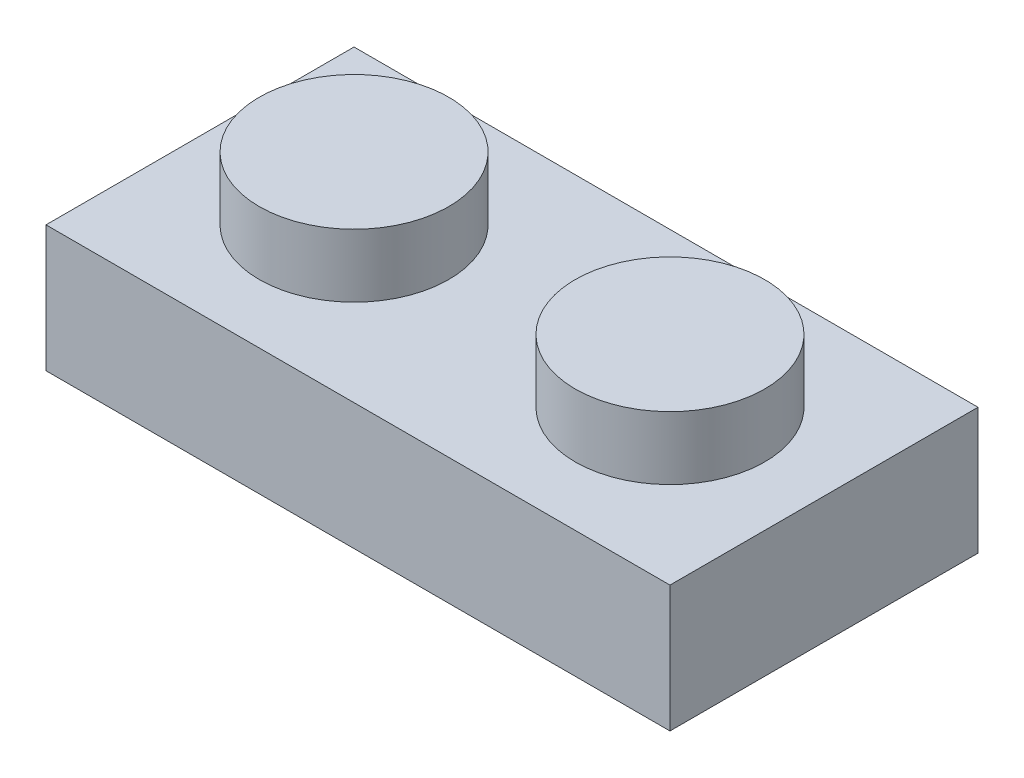
from build123d import *

# Parameters (mm, degrees)
SKETCH1_W            = 15.8
SKETCH1_H            = 3.2
BOSS_EXTRUDE1_DEPTH  = 7.8
SKETCH2_R            = 2.4
BOSS_EXTRUDE2_DEPTH  = 1.6
LPATTERN1_COUNT      = 2
LPATTERN1_PITCH      = 8
LPATTERN1_COUNT_DIR2 = 6
LPATTERN1_PITCH_DIR2 = 8
SHELL1_T             = -1.2
SKETCH3_R            = 1.5
SKETCH3_R_2          = 0.6
BOSS_EXTRUDE3_DEPTH  = 1.8


with BuildPart() as part:
    # Sketch1 → Boss-Extrude1 (new body)
    with BuildSketch(Plane.XY):
        with Locations((7.9, 1.6)):
            Rectangle(SKETCH1_W, SKETCH1_H)
    extrude(amount=-BOSS_EXTRUDE1_DEPTH)

    # Sketch2 → Boss-Extrude2 (add)
    with BuildSketch(Plane(origin=(0, 3.2, 0), x_dir=(1, 0, 0), z_dir=(0, 1, 0))):
        with Locations(Location((3.9, 3.9, 0), (0, 0, 270))):
            Circle(SKETCH2_R)
    boss_extrude2 = extrude(amount=BOSS_EXTRUDE2_DEPTH)

    # LPattern1: Boss-Extrude2 2 × 6, 10 skipped
    with Locations(*[(j * LPATTERN1_PITCH_DIR2, 0, i * LPATTERN1_PITCH) for i in range(LPATTERN1_COUNT) for j in range(LPATTERN1_COUNT_DIR2) if (i, j) not in ((0, 0), (0, 2), (0, 3), (0, 4), (0, 5), (1, 0), (1, 1), (1, 2), (1, 3), (1, 4), (1, 5))]):
        add(boss_extrude2)

    # Shell1
    shell1_openings = [part.faces().sort_by_distance(p)[0] for p in [
        (7.9, 0, -3.9),
    ]]
    offset(amount=SHELL1_T, openings=shell1_openings, kind=Kind.INTERSECTION)

    # Sketch3 → Boss-Extrude3 (add)
    with BuildSketch(Plane.XZ.offset(-2)):
        with Locations(Location((7.9, -3.9, 0), (0, 0, 90))):
            Circle(SKETCH3_R)
        with Locations(Location((7.9, -3.9, 0), (0, 0, 270))):
            Circle(SKETCH3_R_2, mode=Mode.SUBTRACT)
    extrude(amount=BOSS_EXTRUDE3_DEPTH)


solid = part.part
